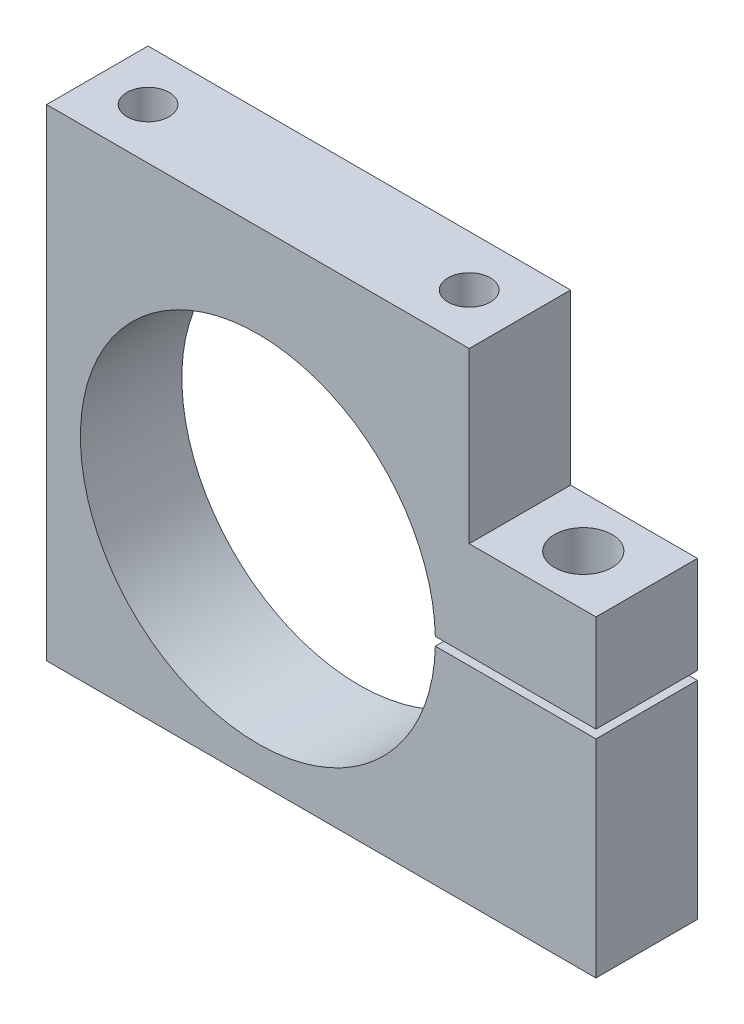
from build123d import *

# Parameters (mm, degrees)
ESBO_O1_R                                   = 21
RESSALTO_EXTRUS_O1_DEPTH                    = 12
ESBO_O2_W                                   = 20
ESBO_O2_H                                   = 1
CORTE_EXTRUS_O1_DEPTH                       = 88.281154896
BROCA_DE_ROSQUEAR_PARA_TARRAXA_DE_M81_D     = 6.8
BROCA_DE_ROSQUEAR_PARA_TARRAXA_DE_M81_DEPTH = 25
BROCA_DE_ROSQUEAR_PARA_TARRAXA_DE_M81_TIP   = 2.042926105
BROCA_DE_ROSQUEAR_PARA_TARRAXA_DE_M62_D     = 5
BROCA_DE_ROSQUEAR_PARA_TARRAXA_DE_M62_DEPTH = 15
BROCA_DE_ROSQUEAR_PARA_TARRAXA_DE_M62_TIP   = 1.502151548
BROCA_DE_ROSQUEAR_PARA_TARRAXA_DE_M63_D     = 5
BROCA_DE_ROSQUEAR_PARA_TARRAXA_DE_M63_DEPTH = 15
BROCA_DE_ROSQUEAR_PARA_TARRAXA_DE_M63_TIP   = 1.502151548


with BuildPart() as part:
    # Esboço1 → Ressalto-extrusão1 (new body)
    with BuildSketch(Plane.XY):
        Polygon((0, 0), (0, 57), (50, 57), (50, 37), (65, 37), (65, 0), align=None)
        with Locations((25, 25)):
            Circle(ESBO_O1_R, mode=Mode.SUBTRACT)
    extrude(amount=RESSALTO_EXTRUS_O1_DEPTH)

    # Esboço2 → Corte-extrusão1 (cut, through all)
    with BuildSketch(Plane.XY.offset(12)):
        with Locations((55, 25)):
            Rectangle(ESBO_O2_W, ESBO_O2_H)
    extrude(amount=-CORTE_EXTRUS_O1_DEPTH, mode=Mode.SUBTRACT)

    # Broca de rosquear para tarraxa de M81
    with Locations(Plane(origin=(0, 37, 0), x_dir=(1, 0, 0), z_dir=(0, 1, 0))):
        with Locations((57.5, -6)):
            Hole(BROCA_DE_ROSQUEAR_PARA_TARRAXA_DE_M81_D / 2, depth=BROCA_DE_ROSQUEAR_PARA_TARRAXA_DE_M81_DEPTH)
            with Locations((0, 0, -(BROCA_DE_ROSQUEAR_PARA_TARRAXA_DE_M81_DEPTH + BROCA_DE_ROSQUEAR_PARA_TARRAXA_DE_M81_TIP / 2))):  # 118° drill point
                Cone(0, BROCA_DE_ROSQUEAR_PARA_TARRAXA_DE_M81_D / 2, BROCA_DE_ROSQUEAR_PARA_TARRAXA_DE_M81_TIP, mode=Mode.SUBTRACT)

    # Broca de rosquear para tarraxa de M62
    with Locations(Plane(origin=(0, 57, 0), x_dir=(1, 0, 0), z_dir=(0, 1, 0))):
        with Locations((6, -6), (44, -6)):
            Hole(BROCA_DE_ROSQUEAR_PARA_TARRAXA_DE_M62_D / 2, depth=BROCA_DE_ROSQUEAR_PARA_TARRAXA_DE_M62_DEPTH)
            with Locations((0, 0, -(BROCA_DE_ROSQUEAR_PARA_TARRAXA_DE_M62_DEPTH + BROCA_DE_ROSQUEAR_PARA_TARRAXA_DE_M62_TIP / 2))):  # 118° drill point
                Cone(0, BROCA_DE_ROSQUEAR_PARA_TARRAXA_DE_M62_D / 2, BROCA_DE_ROSQUEAR_PARA_TARRAXA_DE_M62_TIP, mode=Mode.SUBTRACT)

    # Broca de rosquear para tarraxa de M63
    with Locations(Plane(origin=(0, 0, 0), x_dir=(-1, 0, 0), z_dir=(0, -1, 0))):
        with Locations((-4, -6), (-48, -6)):
            Hole(BROCA_DE_ROSQUEAR_PARA_TARRAXA_DE_M63_D / 2, depth=BROCA_DE_ROSQUEAR_PARA_TARRAXA_DE_M63_DEPTH)
            with Locations((0, 0, -(BROCA_DE_ROSQUEAR_PARA_TARRAXA_DE_M63_DEPTH + BROCA_DE_ROSQUEAR_PARA_TARRAXA_DE_M63_TIP / 2))):  # 118° drill point
                Cone(0, BROCA_DE_ROSQUEAR_PARA_TARRAXA_DE_M63_D / 2, BROCA_DE_ROSQUEAR_PARA_TARRAXA_DE_M63_TIP, mode=Mode.SUBTRACT)


solid = part.part
